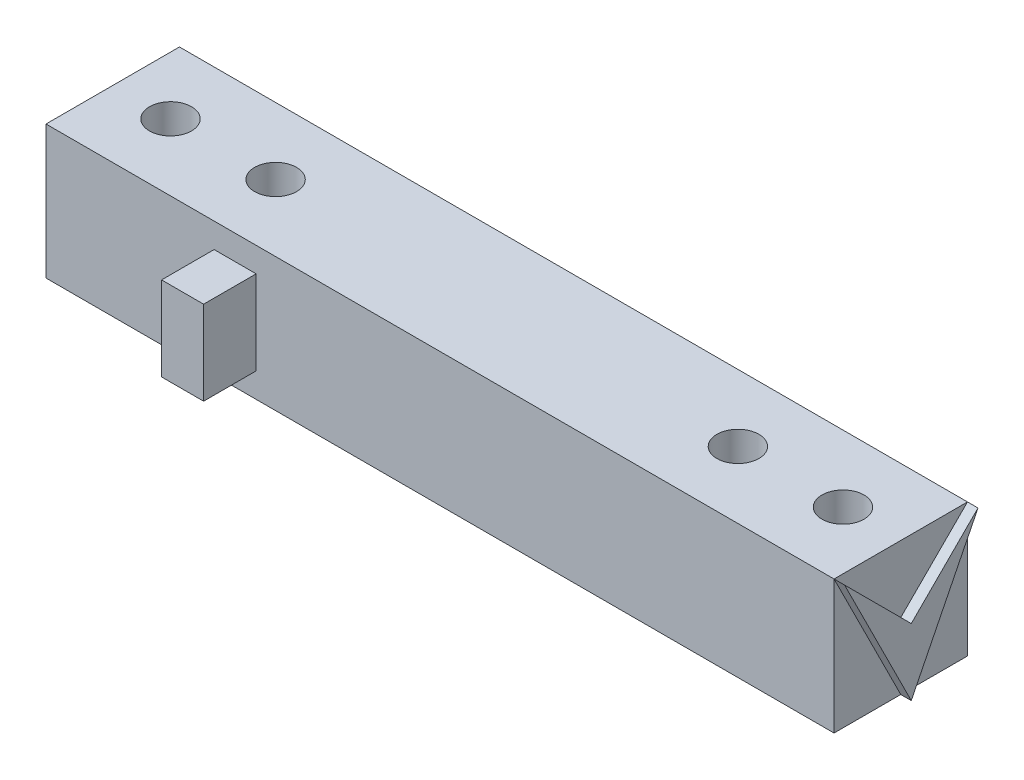
from build123d import *

# Parameters (mm, degrees)
SKETCH1_W                 = 75
SKETCH1_H                 = 12.7
BOSS_EXTRUDE1_DEPTH       = 12.7
F_4_0MM_DOWEL_HOLE1_D     = 4
F_4_0MM_DOWEL_HOLE1_DEPTH = 117.6291
F_4_0MM_DOWEL_HOLE1_TIP   = 1.201721238
SKETCH4_W                 = 4
SKETCH4_H                 = 8
BOSS_EXTRUDE2_DEPTH       = 5
BOSS_EXTRUDE3_DEPTH       = 1


with BuildPart() as part:
    # Sketch1 → Boss-Extrude1 (new body)
    with BuildSketch(Plane(origin=(0, 0, 0), x_dir=(1, 0, 0), z_dir=(0, 1, 0))):
        with Locations((37.5, 6.35)):
            Rectangle(SKETCH1_W, SKETCH1_H)
    extrude(amount=BOSS_EXTRUDE1_DEPTH)

    # Ø4.0mm Dowel Hole1
    with Locations(Plane(origin=(0, 12.7, 0), x_dir=(1, 0, 0), z_dir=(0, 1, 0))):
        with Locations((69.5, 6.35), (59.5, 6.35), (5.5, 6.35), (15.5, 6.35)):
            Hole(F_4_0MM_DOWEL_HOLE1_D / 2, depth=F_4_0MM_DOWEL_HOLE1_DEPTH)
            with Locations((0, 0, -(F_4_0MM_DOWEL_HOLE1_DEPTH + F_4_0MM_DOWEL_HOLE1_TIP / 2))):  # 118° drill point
                Cone(0, F_4_0MM_DOWEL_HOLE1_D / 2, F_4_0MM_DOWEL_HOLE1_TIP, mode=Mode.SUBTRACT)

    # Sketch4 → Boss-Extrude2 (add)
    with BuildSketch(Plane.XY):
        with Locations((18, 6.35)):
            Rectangle(SKETCH4_W, SKETCH4_H)
    extrude(amount=BOSS_EXTRUDE2_DEPTH)

    # Sketch6 → Boss-Extrude3 (add)
    with BuildSketch(Plane(origin=(75, 0, 0), x_dir=(0, 0, -1), z_dir=(1, 0, 0))):
        Polygon((6.35, 0), (12.7, 12.7), (6.35, 6.35), (0, 12.7), align=None)
    extrude(amount=BOSS_EXTRUDE3_DEPTH)


solid = part.part
